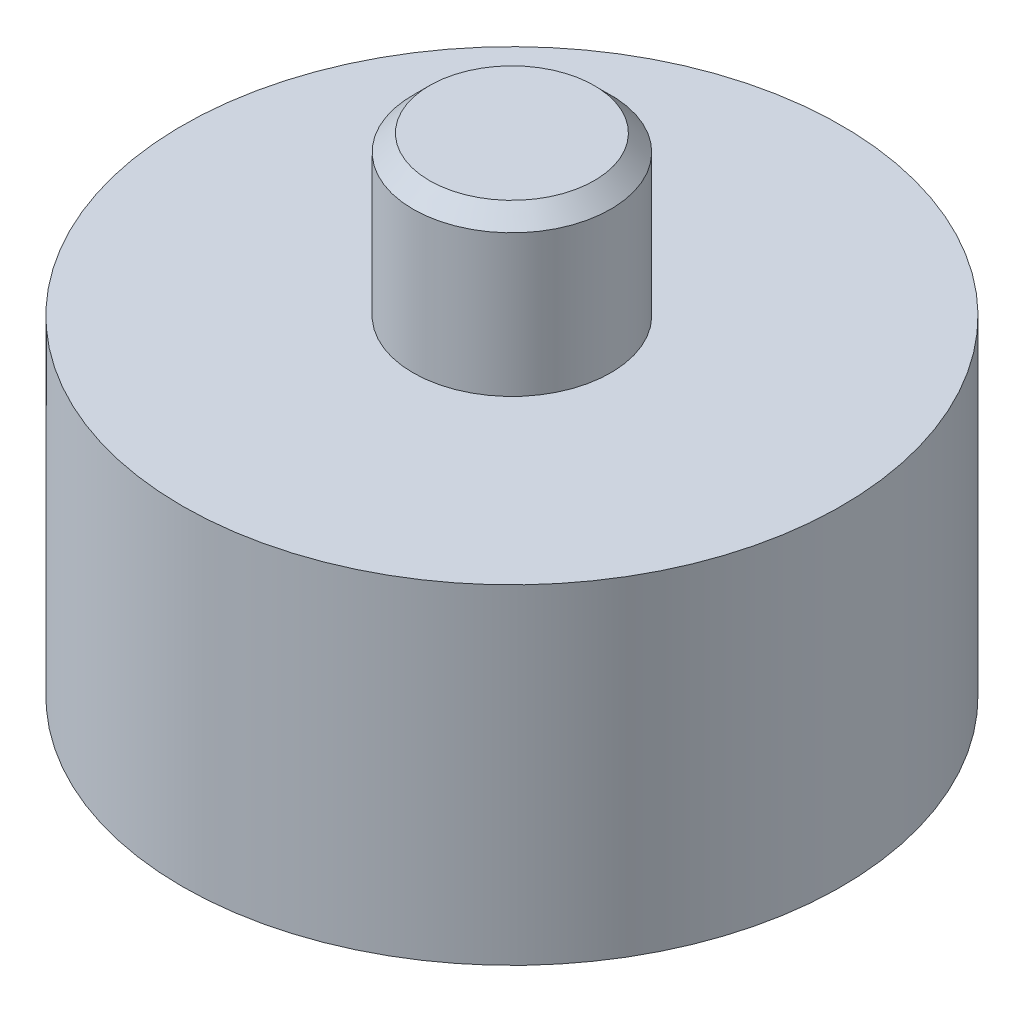
from build123d import *

# Parameters (mm, degrees)
SCHIZZO1_R                   = 10
ESTRUSIONE_ESTRUSIONE1_DEPTH = 10
ESTRUSIONE_ESTRUSIONE2_START = -14.8
SCHIZZO2_R                   = 3
ESTRUSIONE_ESTRUSIONE2_DEPTH = 19.6
TAGLIO_ESTRUSIONE1_START     = -0.5
SCHIZZO3_R                   = 3
TAGLIO_ESTRUSIONE1_DEPTH     = 9.5
SMUSSO1_SIZE                 = 0.5


with BuildPart() as part:
    # Schizzo1 → Estrusione-Estrusione1 (new body)
    with BuildSketch(Plane(origin=(0, 0, 0), x_dir=(1, 0, 0), z_dir=(0, 1, 0))):
        with Locations(Location((0, 0, 0), (0, 0, 270))):
            Circle(SCHIZZO1_R)
    extrude(amount=ESTRUSIONE_ESTRUSIONE1_DEPTH)

    # Schizzo2 → Estrusione-Estrusione2 (add)
    with BuildSketch(Plane.XZ.offset(ESTRUSIONE_ESTRUSIONE2_START)):
        with Locations(Location((0, 0, 0), (0, 0, 270))):
            Circle(SCHIZZO2_R)
    extrude(amount=ESTRUSIONE_ESTRUSIONE2_DEPTH)

    # Schizzo3 → Taglio-Estrusione1 (cut)
    with BuildSketch(Plane.XY.offset(TAGLIO_ESTRUSIONE1_START)):
        with Locations((0, 5)):
            Circle(SCHIZZO3_R)
    extrude(amount=-TAGLIO_ESTRUSIONE1_DEPTH, mode=Mode.SUBTRACT)

    # Smusso1
    smusso1_edges = [part.edges().sort_by_distance(p)[0] for p in [
        (0, -4.8, 3),
        (0, 14.8, 3),
    ]]
    chamfer(smusso1_edges, length=SMUSSO1_SIZE)


solid = part.part
